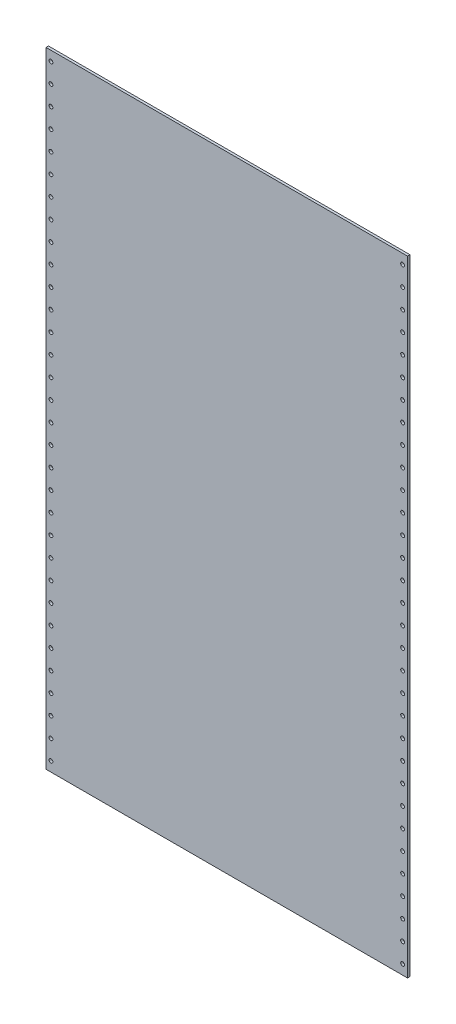
from build123d import *

# Parameters (mm, degrees)
SKETCH1_W           = 469.9
SKETCH1_H           = 812.8
SKETCH1_R           = 2.5
BOSS_EXTRUDE1_DEPTH = 3.175


with BuildPart() as part:
    # Sketch1 → Boss-Extrude1 (new body)
    with BuildSketch(Plane(origin=(0, 0, -1.5875), x_dir=(-1, 0, 0), z_dir=(0, 0, -1))):
        Rectangle(SKETCH1_W, SKETCH1_H)
        with Locations(Location((-228.6, 393.7, 0), (0, 0, 180))):
            Circle(SKETCH1_R, mode=Mode.SUBTRACT)
        with Locations(Location((-228.6, 368.3, 0), (0, 0, 180))):
            Circle(SKETCH1_R, mode=Mode.SUBTRACT)
        with Locations(Location((-228.6, 342.9, 0), (0, 0, 180))):
            Circle(SKETCH1_R, mode=Mode.SUBTRACT)
        with Locations(Location((-228.6, 317.5, 0), (0, 0, 180))):
            Circle(SKETCH1_R, mode=Mode.SUBTRACT)
        with Locations(Location((-228.6, 292.1, 0), (0, 0, 180))):
            Circle(SKETCH1_R, mode=Mode.SUBTRACT)
        with Locations(Location((-228.6, 266.7, 0), (0, 0, 180))):
            Circle(SKETCH1_R, mode=Mode.SUBTRACT)
        with Locations(Location((-228.6, 241.3, 0), (0, 0, 180))):
            Circle(SKETCH1_R, mode=Mode.SUBTRACT)
        with Locations(Location((-228.6, 215.9, 0), (0, 0, 180))):
            Circle(SKETCH1_R, mode=Mode.SUBTRACT)
        with Locations(Location((-228.6, 190.5, 0), (0, 0, 180))):
            Circle(SKETCH1_R, mode=Mode.SUBTRACT)
        with Locations(Location((-228.6, 165.1, 0), (0, 0, 180))):
            Circle(SKETCH1_R, mode=Mode.SUBTRACT)
        with Locations(Location((-228.6, 139.7, 0), (0, 0, 180))):
            Circle(SKETCH1_R, mode=Mode.SUBTRACT)
        with Locations(Location((-228.6, 114.3, 0), (0, 0, 180))):
            Circle(SKETCH1_R, mode=Mode.SUBTRACT)
        with Locations(Location((-228.6, 88.9, 0), (0, 0, 180))):
            Circle(SKETCH1_R, mode=Mode.SUBTRACT)
        with Locations(Location((-228.6, 63.5, 0), (0, 0, 180))):
            Circle(SKETCH1_R, mode=Mode.SUBTRACT)
        with Locations(Location((-228.6, 38.1, 0), (0, 0, 180))):
            Circle(SKETCH1_R, mode=Mode.SUBTRACT)
        with Locations(Location((-228.6, 12.7, 0), (0, 0, 180))):
            Circle(SKETCH1_R, mode=Mode.SUBTRACT)
        with Locations(Location((-228.6, -12.7, 0), (0, 0, 180))):
            Circle(SKETCH1_R, mode=Mode.SUBTRACT)
        with Locations(Location((-228.6, -38.1, 0), (0, 0, 180))):
            Circle(SKETCH1_R, mode=Mode.SUBTRACT)
        with Locations(Location((-228.6, -63.5, 0), (0, 0, 180))):
            Circle(SKETCH1_R, mode=Mode.SUBTRACT)
        with Locations(Location((-228.6, -88.9, 0), (0, 0, 180))):
            Circle(SKETCH1_R, mode=Mode.SUBTRACT)
        with Locations(Location((-228.6, -114.3, 0), (0, 0, 180))):
            Circle(SKETCH1_R, mode=Mode.SUBTRACT)
        with Locations(Location((-228.6, -139.7, 0), (0, 0, 180))):
            Circle(SKETCH1_R, mode=Mode.SUBTRACT)
        with Locations(Location((-228.6, -165.1, 0), (0, 0, 180))):
            Circle(SKETCH1_R, mode=Mode.SUBTRACT)
        with Locations(Location((-228.6, -190.5, 0), (0, 0, 180))):
            Circle(SKETCH1_R, mode=Mode.SUBTRACT)
        with Locations(Location((-228.6, -215.9, 0), (0, 0, 180))):
            Circle(SKETCH1_R, mode=Mode.SUBTRACT)
        with Locations(Location((-228.6, -241.3, 0), (0, 0, 180))):
            Circle(SKETCH1_R, mode=Mode.SUBTRACT)
        with Locations(Location((-228.6, -266.7, 0), (0, 0, 180))):
            Circle(SKETCH1_R, mode=Mode.SUBTRACT)
        with Locations(Location((-228.6, -292.1, 0), (0, 0, 180))):
            Circle(SKETCH1_R, mode=Mode.SUBTRACT)
        with Locations(Location((-228.6, -317.5, 0), (0, 0, 180))):
            Circle(SKETCH1_R, mode=Mode.SUBTRACT)
        with Locations(Location((-228.6, -342.9, 0), (0, 0, 180))):
            Circle(SKETCH1_R, mode=Mode.SUBTRACT)
        with Locations(Location((-228.6, -368.3, 0), (0, 0, 180))):
            Circle(SKETCH1_R, mode=Mode.SUBTRACT)
        with Locations(Location((-228.6, -393.7, 0), (0, 0, 180))):
            Circle(SKETCH1_R, mode=Mode.SUBTRACT)
        with Locations(Location((228.6, 393.7, 0), (0, 0, 180))):
            Circle(SKETCH1_R, mode=Mode.SUBTRACT)
        with Locations(Location((228.6, 368.3, 0), (0, 0, 180))):
            Circle(SKETCH1_R, mode=Mode.SUBTRACT)
        with Locations(Location((228.6, 342.9, 0), (0, 0, 180))):
            Circle(SKETCH1_R, mode=Mode.SUBTRACT)
        with Locations(Location((228.6, 317.5, 0), (0, 0, 180))):
            Circle(SKETCH1_R, mode=Mode.SUBTRACT)
        with Locations(Location((228.6, 292.1, 0), (0, 0, 180))):
            Circle(SKETCH1_R, mode=Mode.SUBTRACT)
        with Locations(Location((228.6, 266.7, 0), (0, 0, 180))):
            Circle(SKETCH1_R, mode=Mode.SUBTRACT)
        with Locations(Location((228.6, 241.3, 0), (0, 0, 180))):
            Circle(SKETCH1_R, mode=Mode.SUBTRACT)
        with Locations(Location((228.6, 215.9, 0), (0, 0, 180))):
            Circle(SKETCH1_R, mode=Mode.SUBTRACT)
        with Locations(Location((228.6, 190.5, 0), (0, 0, 180))):
            Circle(SKETCH1_R, mode=Mode.SUBTRACT)
        with Locations(Location((228.6, 165.1, 0), (0, 0, 180))):
            Circle(SKETCH1_R, mode=Mode.SUBTRACT)
        with Locations(Location((228.6, 139.7, 0), (0, 0, 180))):
            Circle(SKETCH1_R, mode=Mode.SUBTRACT)
        with Locations(Location((228.6, 114.3, 0), (0, 0, 180))):
            Circle(SKETCH1_R, mode=Mode.SUBTRACT)
        with Locations(Location((228.6, 88.9, 0), (0, 0, 180))):
            Circle(SKETCH1_R, mode=Mode.SUBTRACT)
        with Locations(Location((228.6, 63.5, 0), (0, 0, 180))):
            Circle(SKETCH1_R, mode=Mode.SUBTRACT)
        with Locations(Location((228.6, 38.1, 0), (0, 0, 180))):
            Circle(SKETCH1_R, mode=Mode.SUBTRACT)
        with Locations(Location((228.6, 12.7, 0), (0, 0, 180))):
            Circle(SKETCH1_R, mode=Mode.SUBTRACT)
        with Locations(Location((228.6, -12.7, 0), (0, 0, 180))):
            Circle(SKETCH1_R, mode=Mode.SUBTRACT)
        with Locations(Location((228.6, -38.1, 0), (0, 0, 180))):
            Circle(SKETCH1_R, mode=Mode.SUBTRACT)
        with Locations(Location((228.6, -63.5, 0), (0, 0, 180))):
            Circle(SKETCH1_R, mode=Mode.SUBTRACT)
        with Locations(Location((228.6, -88.9, 0), (0, 0, 180))):
            Circle(SKETCH1_R, mode=Mode.SUBTRACT)
        with Locations(Location((228.6, -114.3, 0), (0, 0, 180))):
            Circle(SKETCH1_R, mode=Mode.SUBTRACT)
        with Locations(Location((228.6, -139.7, 0), (0, 0, 180))):
            Circle(SKETCH1_R, mode=Mode.SUBTRACT)
        with Locations(Location((228.6, -165.1, 0), (0, 0, 180))):
            Circle(SKETCH1_R, mode=Mode.SUBTRACT)
        with Locations(Location((228.6, -190.5, 0), (0, 0, 180))):
            Circle(SKETCH1_R, mode=Mode.SUBTRACT)
        with Locations(Location((228.6, -215.9, 0), (0, 0, 180))):
            Circle(SKETCH1_R, mode=Mode.SUBTRACT)
        with Locations(Location((228.6, -241.3, 0), (0, 0, 180))):
            Circle(SKETCH1_R, mode=Mode.SUBTRACT)
        with Locations(Location((228.6, -266.7, 0), (0, 0, 180))):
            Circle(SKETCH1_R, mode=Mode.SUBTRACT)
        with Locations(Location((228.6, -292.1, 0), (0, 0, 180))):
            Circle(SKETCH1_R, mode=Mode.SUBTRACT)
        with Locations(Location((228.6, -317.5, 0), (0, 0, 180))):
            Circle(SKETCH1_R, mode=Mode.SUBTRACT)
        with Locations(Location((228.6, -342.9, 0), (0, 0, 180))):
            Circle(SKETCH1_R, mode=Mode.SUBTRACT)
        with Locations(Location((228.6, -368.3, 0), (0, 0, 180))):
            Circle(SKETCH1_R, mode=Mode.SUBTRACT)
        with Locations(Location((228.6, -393.7, 0), (0, 0, 180))):
            Circle(SKETCH1_R, mode=Mode.SUBTRACT)
    extrude(amount=-BOSS_EXTRUDE1_DEPTH)


solid = part.part
